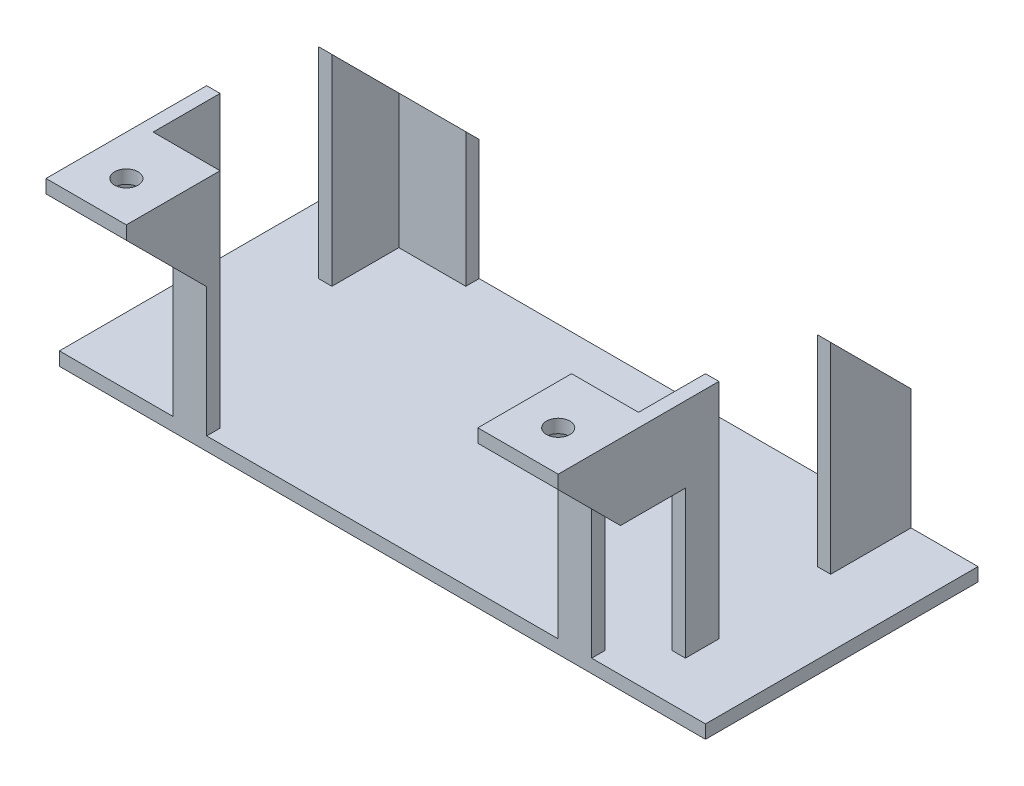
from build123d import *

# Parameters (mm, degrees)
CROQUIS1_W               = 76.5
CROQUIS1_H               = 40.7
SALIENTE_EXTRUIR1_DEPTH  = 2
CROQUIS2_W               = 2
CROQUIS2_H               = 5
CROQUIS2_W_2             = 5
CROQUIS2_H_2             = 2
SALIENTE_EXTRUIR2_DEPTH  = 33.3
CROQUIS3_W               = 12
CROQUIS3_H               = 2
SALIENTE_EXTRUIR3_DEPTH  = 12
NERVIO2_REACH            = 92.249
CROQUIS4_WALL_W          = 199.468346668
CROQUIS4_WALL_H          = 2
NERVIO7_REACH            = 82.33
CROQUIS5_WALL_W          = 179.62998513
CROQUIS5_WALL_H          = 2
NERVIO8_REACH            = 82.33
CROQUIS6_WALL_W          = 179.62998513
CROQUIS6_WALL_H          = 2
NERVIO9_REACH            = 92.249
CROQUIS7_WALL_W          = 199.468346668
CROQUIS7_WALL_H          = 2
CROQUIS8_R               = 1.75
CORTAR_EXTRUIR2_DEPTH    = 12
CROQUIS9_W               = 5
CROQUIS9_H               = 2
SALIENTE_EXTRUIR4_DEPTH  = 8
CROQUIS10_W              = 5
CROQUIS10_H              = 2
SALIENTE_EXTRUIR5_DEPTH  = 8
CROQUIS11_W              = 5
CROQUIS11_H              = 2
SALIENTE_EXTRUIR7_DEPTH  = 8
SALIENTE_EXTRUIR8_DEPTH  = 33.3
CORTAR_EXTRUIR5_START    = 8
CORTAR_EXTRUIR5_DEPTH    = 106.122924688
CORTAR_EXTRUIR6_DEPTH    = 22
CROQUIS15_W              = 2
CROQUIS15_H              = 2.7
CORTAR_EXTRUIR7_DEPTH    = 15
CROQUIS16_W              = 40.7
CROQUIS16_H              = 2
SALIENTE_EXTRUIR9_DEPTH  = 10
CROQUIS17_W              = 40.7
CROQUIS17_H              = 2
SALIENTE_EXTRUIR10_DEPTH = 10


with BuildPart() as part:
    # Croquis1 → Saliente-Extruir1 (new body)
    with BuildSketch(Plane(origin=(0, 0, 0), x_dir=(1, 0, 0), z_dir=(0, 1, 0))):
        Rectangle(CROQUIS1_W, CROQUIS1_H)
    extrude(amount=SALIENTE_EXTRUIR1_DEPTH)

    # Croquis2 → Saliente-Extruir2 (add)
    with BuildSketch(Plane(origin=(0, 2, 0), x_dir=(1, 0, 0), z_dir=(0, 1, 0))):
        Polygon((-36.25, -8.35), (-38.25, -8.35), (-38.25, -20.35), (-26.25, -20.35), (-26.25, -18.35), (-36.25, -18.35), align=None)
        with Locations((-37.25, 10.85)):
            Rectangle(CROQUIS2_W, CROQUIS2_H)
        with Locations((-28.75, 19.35)):
            Rectangle(CROQUIS2_W_2, CROQUIS2_H_2)
        with Locations((28.75, 19.35)):
            Rectangle(CROQUIS2_W_2, CROQUIS2_H_2)
        with Locations((37.25, 10.85)):
            Rectangle(CROQUIS2_W, CROQUIS2_H)
        Polygon((38.25, -20.35), (38.25, -8.35), (36.25, -8.35), (36.25, -18.35), (26.25, -18.35), (26.25, -20.35), align=None)
    extrude(amount=SALIENTE_EXTRUIR2_DEPTH)

    # Croquis3 → Saliente-Extruir3 (add)
    with BuildSketch(Plane.XY.offset(20.35)):
        with Locations((-32.25, 34.3)):
            Rectangle(CROQUIS3_W, CROQUIS3_H)
        with Locations((32.25, 34.3)):
            Rectangle(CROQUIS3_W, CROQUIS3_H)
    extrude(amount=SALIENTE_EXTRUIR3_DEPTH)

    # Croquis4 wall → Nervio2 (add, up to next)
    with BuildSketch(Plane(origin=(-38.25, 27.3, 26.35), x_dir=(0, -0.707106781187, -0.707106781187), z_dir=(0, -0.707106781187, 0.707106781187)), mode=Mode.PRIVATE) as nervio2_sk1:
        with Locations((0, 1)):
            Rectangle(CROQUIS4_WALL_W, CROQUIS4_WALL_H)
    nervio2_tool1 = extrude(nervio2_sk1.sketch, amount=-NERVIO2_REACH, mode=Mode.PRIVATE) - part.part
    add(nervio2_tool1.solids().sort_by_distance((-38.25, 27.3, 26.35))[0])

    # Croquis5 wall → Nervio7 (add, up to next)
    with BuildSketch(Plane(origin=(-26.25, 27.3, 26.35), x_dir=(0, -0.707106781187, -0.707106781187), z_dir=(0, 0.707106781187, -0.707106781187)), mode=Mode.PRIVATE) as nervio7_sk1:
        with Locations((0, 1)):
            Rectangle(CROQUIS5_WALL_W, CROQUIS5_WALL_H)
    nervio7_tool1 = extrude(nervio7_sk1.sketch, amount=NERVIO7_REACH, mode=Mode.PRIVATE) - part.part
    add(nervio7_tool1.solids().sort_by_distance((-26.25, 27.3, 26.35))[0])

    # Croquis6 wall → Nervio8 (add, up to next)
    with BuildSketch(Plane(origin=(26.25, 27.3, 26.35), x_dir=(0, -0.707106781187, -0.707106781187), z_dir=(0, -0.707106781187, 0.707106781187)), mode=Mode.PRIVATE) as nervio8_sk1:
        with Locations((0, 1)):
            Rectangle(CROQUIS6_WALL_W, CROQUIS6_WALL_H)
    nervio8_tool1 = extrude(nervio8_sk1.sketch, amount=-NERVIO8_REACH, mode=Mode.PRIVATE) - part.part
    add(nervio8_tool1.solids().sort_by_distance((26.25, 27.3, 26.35))[0])

    # Croquis7 wall → Nervio9 (add, up to next)
    with BuildSketch(Plane(origin=(38.25, 27.3, 26.35), x_dir=(0, -0.707106781187, -0.707106781187), z_dir=(0, 0.707106781187, -0.707106781187)), mode=Mode.PRIVATE) as nervio9_sk1:
        with Locations((0, 1)):
            Rectangle(CROQUIS7_WALL_W, CROQUIS7_WALL_H)
    nervio9_tool1 = extrude(nervio9_sk1.sketch, amount=NERVIO9_REACH, mode=Mode.PRIVATE) - part.part
    add(nervio9_tool1.solids().sort_by_distance((38.25, 27.3, 26.35))[0])

    # Croquis8 → Cortar-Extruir2 (cut)
    with BuildSketch(Plane(origin=(0, 35.3, 0), x_dir=(1, 0, 0), z_dir=(0, 1, 0))):
        with Locations(Location((-32.25, -26.35, 0), (0, 0, 270))):
            Circle(CROQUIS8_R)
        with Locations(Location((32.25, -26.35, 0), (0, 0, 270))):
            Circle(CROQUIS8_R)
    extrude(amount=-CORTAR_EXTRUIR2_DEPTH, mode=Mode.SUBTRACT)

    # Croquis9 → Saliente-Extruir4 (add)
    with BuildSketch(Plane(origin=(38.25, 0, 0), x_dir=(0, 0, -1), z_dir=(1, 0, 0))):
        with Locations((10.85, 34.3)):
            Rectangle(CROQUIS9_W, CROQUIS9_H)
    extrude(amount=SALIENTE_EXTRUIR4_DEPTH)

    # Croquis10 → Saliente-Extruir5 (add)
    with BuildSketch(Plane.ZY.offset(38.25)):
        with Locations((-10.85, 34.3)):
            Rectangle(CROQUIS10_W, CROQUIS10_H)
    extrude(amount=SALIENTE_EXTRUIR5_DEPTH)

    # Croquis11 → Saliente-Extruir7 (add)
    with BuildSketch(Plane(origin=(0, 0, -20.35), x_dir=(-1, 0, 0), z_dir=(0, 0, -1))):
        with Locations((-28.75, 34.3)):
            Rectangle(CROQUIS11_W, CROQUIS11_H)
        with Locations((28.75, 34.3)):
            Rectangle(CROQUIS11_W, CROQUIS11_H)
    extrude(amount=SALIENTE_EXTRUIR7_DEPTH)

    # Croquis13 → Saliente-Extruir8 (add)
    with BuildSketch(Plane(origin=(0, 2, 0), x_dir=(1, 0, 0), z_dir=(0, 1, 0))):
        Polygon((-38.25, 13.35), (-38.25, 20.35), (-31.25, 20.35), (-31.25, 18.35), (-36.25, 18.35), (-36.25, 13.35), align=None)
        Polygon((31.25, 20.35), (31.25, 18.35), (36.25, 18.35), (36.25, 13.35), (38.25, 13.35), (38.25, 20.35), align=None)
    extrude(amount=SALIENTE_EXTRUIR8_DEPTH)

    # Croquis12 → Cortar-Extruir5 (cut, through all)
    with BuildSketch(Plane.ZY.offset(38.25).offset(CORTAR_EXTRUIR5_START)):
        Polygon((-8.35, 32), (-8.35, 35.3), (-28.35, 35.3), (-28.35, 12), align=None)
    extrude(amount=-CORTAR_EXTRUIR5_DEPTH, mode=Mode.SUBTRACT)

    # Croquis14 → Cortar-Extruir6 (cut)
    with BuildSketch(Plane(origin=(0, 2, 0), x_dir=(1, 0, 0), z_dir=(0, 1, 0))):
        Polygon((-36.25, -13.35), (-38.25, -13.35), (-38.25, -20.35), (-31.25, -20.35), (-31.25, -18.35), (-36.25, -18.35), align=None)
        Polygon((31.25, -18.35), (31.25, -20.35), (38.25, -20.35), (38.25, -13.35), (36.25, -13.35), (36.25, -18.35), align=None)
    extrude(amount=CORTAR_EXTRUIR6_DEPTH, mode=Mode.SUBTRACT)

    # Croquis15 → Cortar-Extruir7 (cut)
    with BuildSketch(Plane.XY.offset(20.35)):
        with Locations((-37.25, 22.65)):
            Rectangle(CROQUIS15_W, CROQUIS15_H)
        with Locations((37.25, 22.65)):
            Rectangle(CROQUIS15_W, CROQUIS15_H)
    extrude(amount=CORTAR_EXTRUIR7_DEPTH, mode=Mode.SUBTRACT)

    # Croquis16 → Saliente-Extruir9 (add)
    with BuildSketch(Plane.ZY.offset(38.25)):
        with Locations((0, 1)):
            Rectangle(CROQUIS16_W, CROQUIS16_H)
    extrude(amount=SALIENTE_EXTRUIR9_DEPTH)

    # Croquis17 → Saliente-Extruir10 (add)
    with BuildSketch(Plane(origin=(38.25, 0, 0), x_dir=(0, 0, -1), z_dir=(1, 0, 0))):
        with Locations((0, 1)):
            Rectangle(CROQUIS17_W, CROQUIS17_H)
    extrude(amount=SALIENTE_EXTRUIR10_DEPTH)


solid = part.part
